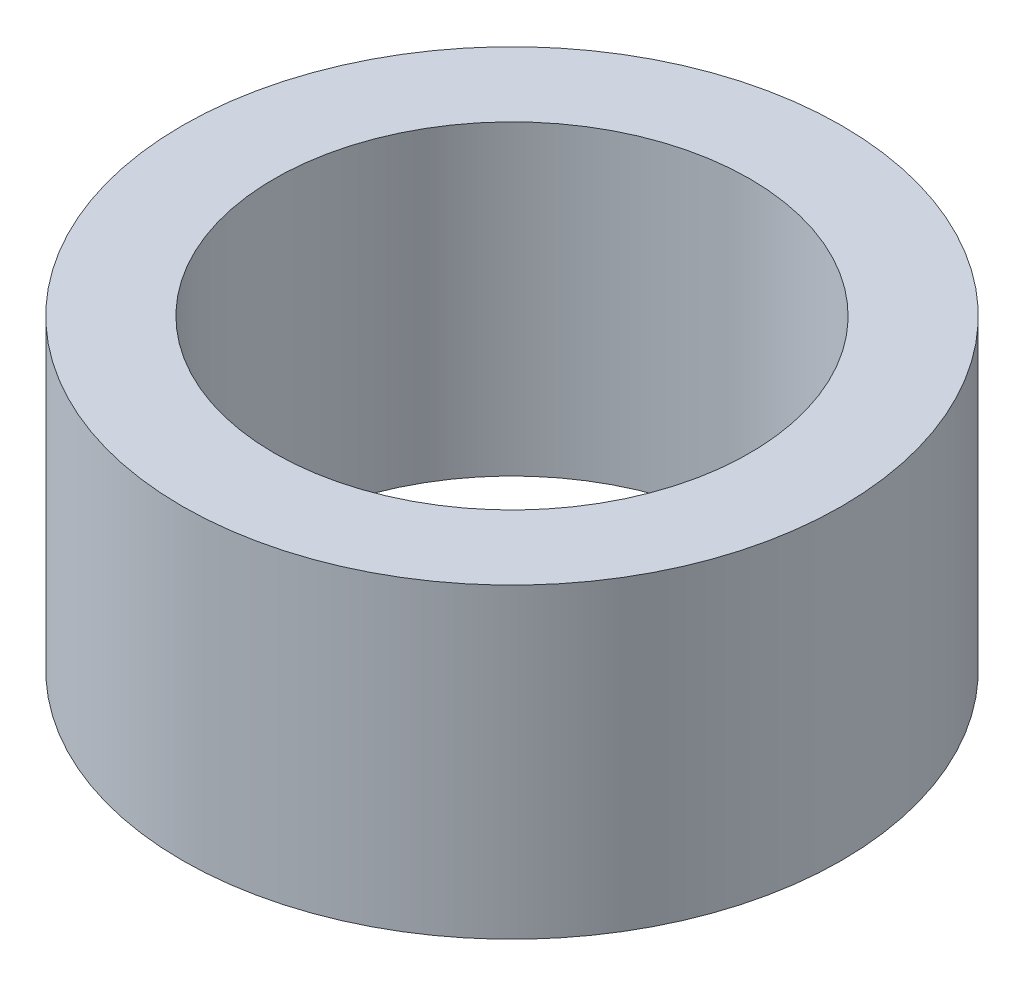
from build123d import *

# Parameters (mm, degrees)
SKETCH_1_R      = 21.5
SKETCH_1_R_2    = 15.5
EXTRUDE_1_DEPTH = 20


with BuildPart() as part:
    # 草图1 → 凸台-拉伸1 (new body)
    with BuildSketch(Plane(origin=(0, 0, 0), x_dir=(1, 0, 0), z_dir=(0, 1, 0))):
        with Locations(Location((0, 0, 0), (0, 0, 270))):
            Circle(SKETCH_1_R)
        with Locations(Location((0, 0, 0), (0, 0, 270))):
            Circle(SKETCH_1_R_2, mode=Mode.SUBTRACT)
    extrude(amount=EXTRUDE_1_DEPTH)


solid = part.part
